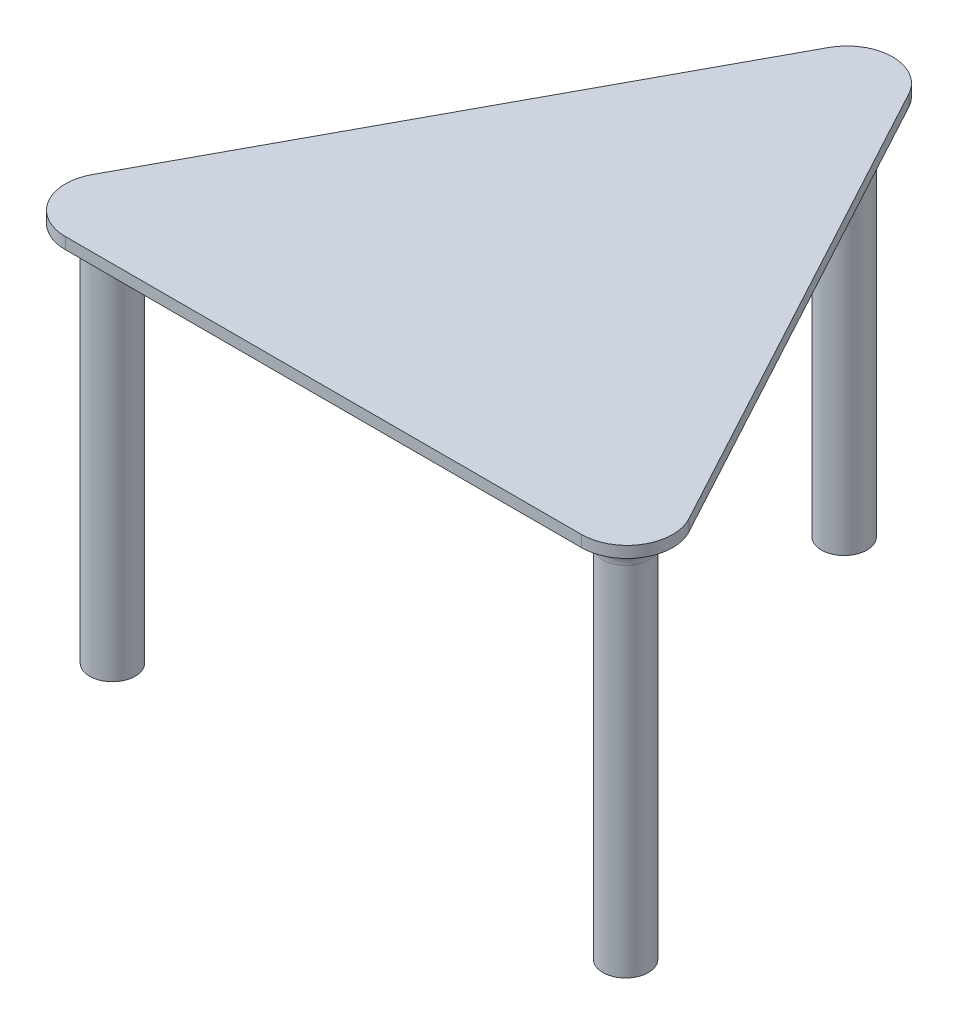
from build123d import *

# Parameters (mm, degrees)
BOSS_EXTRUDE1_DEPTH = 1.2000000000000002
SKETCH1_3_R         = 2.399999999999999
SKETCH1_3_R_2       = 1.0000000000000018
SKETCH1_3_R_3       = 2.400000000000001
SKETCH1_3_R_4       = 0.9999999999999983
BOSS_EXTRUDE2_DEPTH = 39.99999999999998
FILLET1_R           = 2.4


with BuildPart() as part:
    # Sketch1 → Boss-Extrude1 (new body)
    with BuildSketch(Plane(origin=(0, 0, 0), x_dir=(1, 0, 0), z_dir=(0, 1, 0))):
        with BuildLine():
            ThreePointArc((-36.71396637362992, 35.40070719531131), (-40.93772893772893, 37.9203936637732), (-45.16149150182793, 35.40070719531131))
            Line((-45.16149150182793, 35.40070719531131), (-72.31522838082492, -14.895419069194496))
            ThreePointArc((-72.31522838082492, -14.895419069194494), (-72.21369245723122, -19.634847792078578), (-68.09146581672593, -21.975732600732602))
            Line((-68.09146581672593, -21.9757326007326), (-13.783992058731933, -21.9757326007326))
            ThreePointArc((-13.783992058731934, -21.975732600732595), (-9.66176541822665, -19.634847792078567), (-9.560229494632928, -14.895419069194485))
            Line((-9.56022949463293, -14.895419069194485), (-36.71396637362993, 35.40070719531131))
        make_face()
    extrude(amount=BOSS_EXTRUDE1_DEPTH)

    # Sketch1<3> → Boss-Extrude2 (add)
    # profile 1 of 3: a face of its own
    with BuildSketch(Plane(origin=(0, 0, 0), x_dir=(1, 0, 0), z_dir=(0, 1, 0))):
        with Locations((-13.937728937728926, -17.175732600732594)):
            Circle(SKETCH1_3_R)
        with Locations((-13.937728937728918, -17.175732600732594)):
            Circle(SKETCH1_3_R_2, mode=Mode.SUBTRACT)
    # profile 2 of 3: a face of its own
    with BuildSketch(Plane(origin=(0, 0, 0), x_dir=(1, 0, 0), z_dir=(0, 1, 0))):
        with Locations((-67.93772893772892, -17.175732600732594)):
            Circle(SKETCH1_3_R_3)
        with Locations((-67.93772893772892, -17.175732600732594)):
            Circle(SKETCH1_3_R_4, mode=Mode.SUBTRACT)
    # profile 3 of 3: a face of its own
    with BuildSketch(Plane(origin=(0, 0, 0), x_dir=(1, 0, 0), z_dir=(0, 1, 0))):
        with Locations((-40.93772893772893, 32.82426739926741)):
            Circle(SKETCH1_3_R_3)
        with Locations((-40.93772893772893, 32.82426739926741)):
            Circle(SKETCH1_3_R_4, mode=Mode.SUBTRACT)
    extrude(amount=-BOSS_EXTRUDE2_DEPTH)

    # Fillet1
    fillet1_edges = [part.edges().sort_by_distance(p)[0] for p in [
        (-70.33772893772893, 0, 17.175732600732594),
        (-16.337728937728926, 0, 17.175732600732594),
        (-43.337728937728926, 0, -32.82426739926741),
    ]]
    fillet(fillet1_edges, radius=FILLET1_R)


solid = part.part
